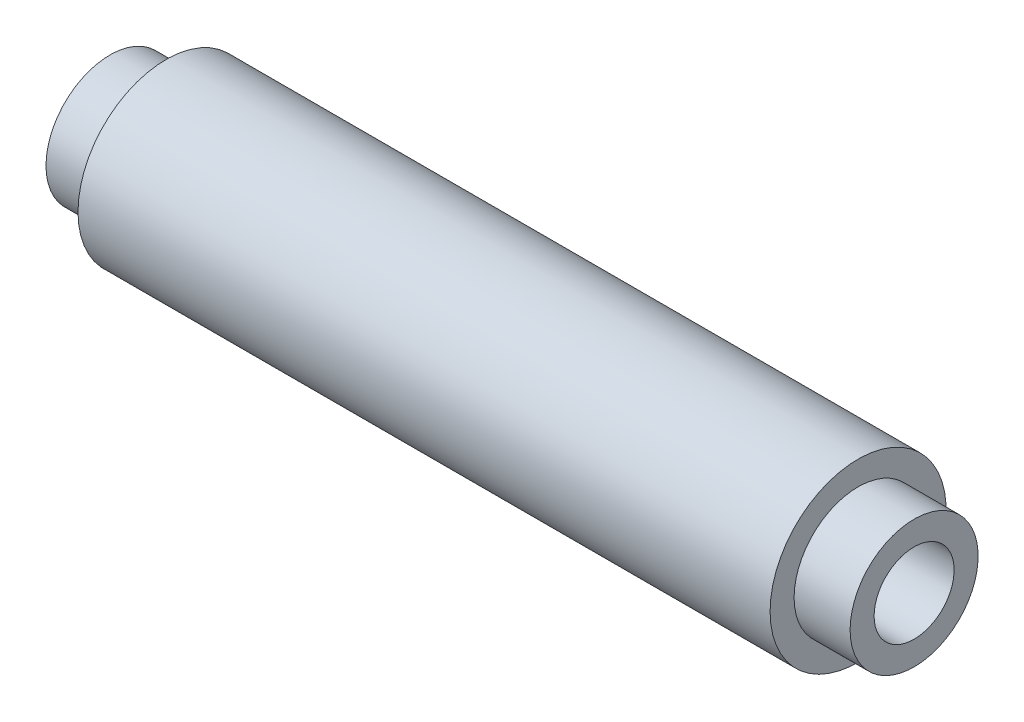
from build123d import *


with BuildPart() as part:
    # Sketch1 → Revolve1 (revolve)
    with BuildSketch(Plane.XY, mode=Mode.PRIVATE) as revolve1_sk:
        Polygon((0, 2.5), (12.5, 2.5), (12.5, 0), (37.75, 0), (37.75, 2.5), (50.25, 2.5), (50.25, 4), (46.75, 4), (46.75, 5.5), (3.5, 5.5), (3.5, 4), (0, 4), align=None)
    revolve(revolve1_sk.sketch.rotate(Axis((0, 0, 0), (1, 0, 0)), 90), axis=Axis((0, 0, 0), (1, 0, 0)))


solid = part.part
